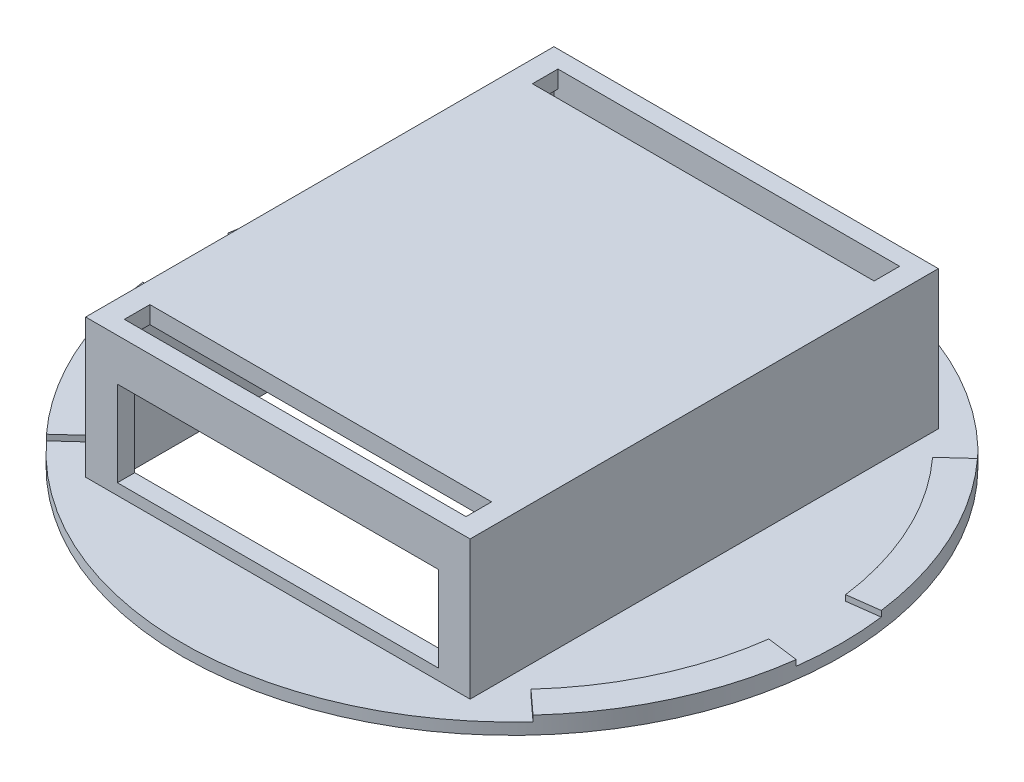
from build123d import *

# Parameters (mm, degrees)
SKETCH1_R           = 57
BOSS_EXTRUDE1_DEPTH = 2
BOSS_EXTRUDE3_DEPTH = 3
SKETCH2_W           = 66.5
SKETCH2_H           = 81
CUT_EXTRUDE1_DEPTH  = 3
SKETCH2_2_W         = 66.5
SKETCH2_2_H         = 81
BOSS_EXTRUDE4_DEPTH = 24
SHELL1_T            = -3
SKETCH3_W           = 55.519367608
SKETCH3_H           = 14.772337279
CUT_EXTRUDE2_DEPTH  = 8
SKETCH4_W           = 59.1038318
SKETCH4_H           = 4.416523669
CUT_EXTRUDE5_DEPTH  = 8
SKETCH5_R           = 1
SKETCH5_W           = 4.5
SKETCH5_H           = 10
CUT_EXTRUDE6_DEPTH  = 8


with BuildPart() as part:
    # Sketch1 → Boss-Extrude1 (new body)
    with BuildSketch(Plane(origin=(0, 0, 0), x_dir=(1, 0, 0), z_dir=(0, 1, 0))):
        Circle(SKETCH1_R)
    extrude(amount=BOSS_EXTRUDE1_DEPTH)

    # Sketch1<4> → Boss-Extrude3 (add)
    with BuildSketch(Plane(origin=(0, 0, 0), x_dir=(1, 0, 0), z_dir=(0, 1, 0))):
        with BuildLine():
            ThreePointArc((-42.082780538, 38.445280363), (-51.695779903, 24.011379391), (-56.523502612, 7.35483871))
            Line((-56.523502612, 7.35483871), (-51.06948043, 6.64516129))
            ThreePointArc((-51.06948043, 6.64516129), (-46.707590614, 21.694491906), (-38.022161363, 34.735648047))
            Line((-38.022161363, 34.735648047), (-42.082780538, 38.445280363))
        make_face()
        with BuildLine():
            Line((-51.06948043, -6.64516129), (-56.523502612, -7.35483871))
            ThreePointArc((-56.523502612, -7.35483871), (-51.695779903, -24.011379391), (-42.082780538, -38.445280363))
            Line((-42.082780538, -38.445280363), (-38.022161363, -34.735648047))
            ThreePointArc((-38.022161363, -34.735648047), (-46.707590614, -21.694491906), (-51.06948043, -6.64516129))
        make_face()
        with BuildLine():
            ThreePointArc((56.523502612, 7.35483871), (51.695779903, 24.011379391), (42.082780538, 38.445280363))
            Line((42.082780538, 38.445280363), (38.022161363, 34.735648047))
            ThreePointArc((38.022161363, 34.735648047), (46.707590614, 21.694491906), (51.06948043, 6.64516129))
            Line((51.06948043, 6.64516129), (56.523502612, 7.35483871))
        make_face()
        with BuildLine():
            Line((38.022161363, -34.735648047), (42.082780538, -38.445280363))
            ThreePointArc((42.082780538, -38.445280363), (51.695779903, -24.011379391), (56.523502612, -7.35483871))
            Line((56.523502612, -7.35483871), (51.06948043, -6.64516129))
            ThreePointArc((51.06948043, -6.64516129), (46.707590614, -21.694491906), (38.022161363, -34.735648047))
        make_face()
    extrude(amount=BOSS_EXTRUDE3_DEPTH)

    # Sketch2 → Cut-Extrude1 (cut)
    with BuildSketch(Plane(origin=(0, 2, 0), x_dir=(1, 0, 0), z_dir=(0, 1, 0))):
        Rectangle(SKETCH2_W, SKETCH2_H)
    extrude(amount=-CUT_EXTRUDE1_DEPTH, mode=Mode.SUBTRACT)

    # Sketch5 → Cut-Extrude6 (cut)
    with BuildSketch(Plane.XZ):
        with Locations((-46.225250229, 7)):
            Circle(SKETCH5_R)
        with Locations((-46.225250229, -7)):
            Circle(SKETCH5_R)
        with Locations((-46.225250229, 0)):
            Rectangle(SKETCH5_W, SKETCH5_H)
    extrude(amount=-CUT_EXTRUDE6_DEPTH, mode=Mode.SUBTRACT)


with BuildPart() as body_2:
    # Sketch2<2> → Boss-Extrude4 (new body)
    with BuildSketch(Plane(origin=(0, 2, 0), x_dir=(1, 0, 0), z_dir=(0, 1, 0))):
        Rectangle(SKETCH2_2_W, SKETCH2_2_H)
    extrude(amount=BOSS_EXTRUDE4_DEPTH)

    # Shell1
    shell1_openings = [body_2.faces().sort_by_distance(p)[0] for p in [
        (0, 2, 0),
    ]]
    offset(amount=SHELL1_T, openings=shell1_openings, kind=Kind.INTERSECTION)

    # Sketch3 → Cut-Extrude2 (cut)
    with BuildSketch(Plane(origin=(0, 0, -40.5), x_dir=(-1, 0, 0), z_dir=(0, 0, -1))):
        with Locations((0, 11.307757027)):
            Rectangle(SKETCH3_W, SKETCH3_H)
    cut_extrude2 = extrude(amount=-CUT_EXTRUDE2_DEPTH, mode=Mode.SUBTRACT)

    # Mirror1: Cut-Extrude2 across plane
    add(cut_extrude2.mirror(Plane.XY), mode=Mode.SUBTRACT)

    # Sketch4 → Cut-Extrude5 (cut)
    with BuildSketch(Plane(origin=(0, 26, 0), x_dir=(1, 0, 0), z_dir=(0, 1, 0))):
        with Locations((0, -35.291738165)):
            Rectangle(SKETCH4_W, SKETCH4_H)
        with Locations((0, 35.291738165)):
            Rectangle(SKETCH4_W, SKETCH4_H)
    extrude(amount=-CUT_EXTRUDE5_DEPTH, mode=Mode.SUBTRACT)


solid = Compound([part.part, body_2.part])
